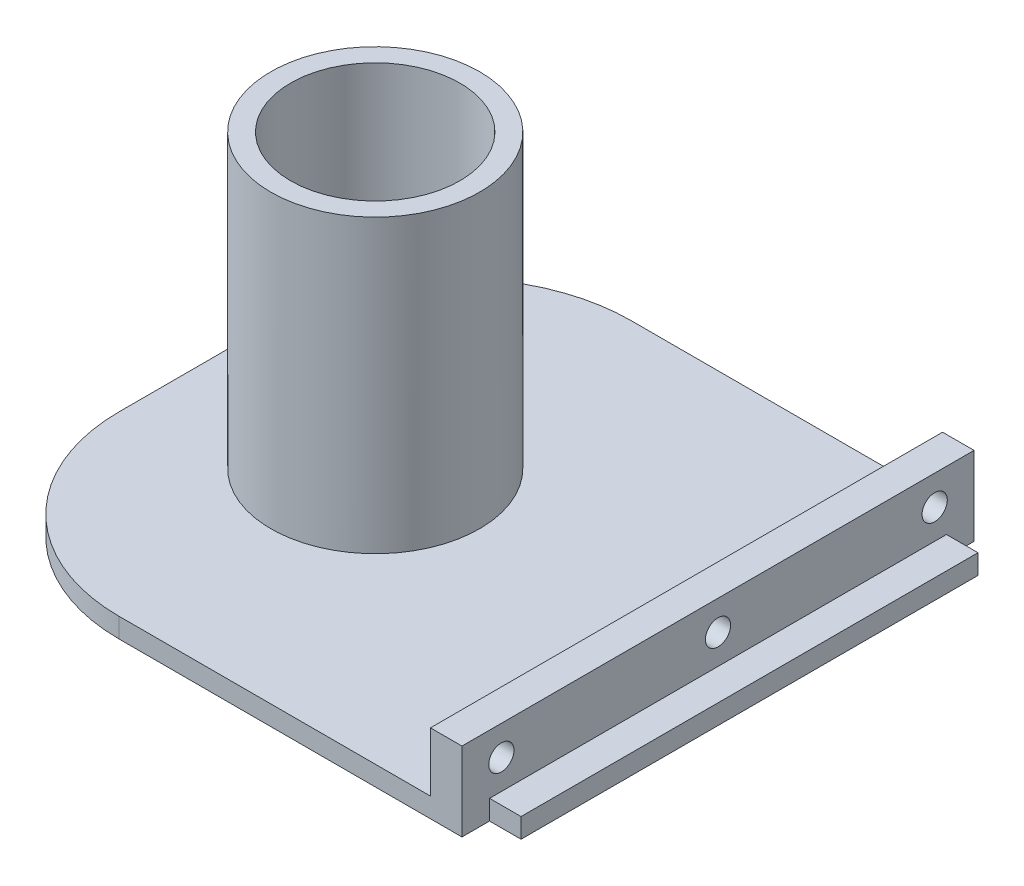
from build123d import *

# Parameters (mm, degrees)
BOSS_EXTRUDE1_DEPTH = 1.25
SKETCH3_R           = 13.25
SKETCH3_R_2         = 10.75
BOSS_EXTRUDE2_DEPTH = 37
SKETCH4_W           = 4
SKETCH4_H           = 65
BOSS_EXTRUDE3_DEPTH = 7.5
SKETCH5_R           = 1.6
CUT_EXTRUDE1_DEPTH  = 7.5
CHAMFER1_SIZE       = 1.5


with BuildPart() as part:
    # Sketch1 → Boss-Extrude1 (new, symmetric)
    with BuildSketch(Plane(origin=(0, 0, 0), x_dir=(1, 0, 0), z_dir=(0, 1, 0))):
        with BuildLine():
            Line((31, 32.5), (31, 29))
            Line((31, 29), (35, 29))
            Line((35, 29), (35, -29))
            Line((35, -29), (31, -29))
            Line((31, -29), (31, -32.5))
            Line((31, -32.5), (-12.51, -32.5))
            ThreePointArc((-12.51, -32.5), (-28.412831509, -25.912831509), (-35, -10.01))
            Line((-35, -10.01), (-35, 10.01))
            ThreePointArc((-35, 10.01), (-28.412831509, 25.912831509), (-12.51, 32.5))
            Line((-12.51, 32.5), (31, 32.5))
        make_face()
    extrude(amount=BOSS_EXTRUDE1_DEPTH, both=True)

    # Sketch3 → Boss-Extrude2 (add)
    with BuildSketch(Plane(origin=(0, 1.25, 0), x_dir=(1, 0, 0), z_dir=(0, 1, 0))):
        with Locations(Location((-12.51, 0, 0), (0, 0, 90))):
            Circle(SKETCH3_R)
        with Locations(Location((-12.51, 0, 0), (0, 0, 270))):
            Circle(SKETCH3_R_2, mode=Mode.SUBTRACT)
    extrude(amount=BOSS_EXTRUDE2_DEPTH)

    # Sketch4 → Boss-Extrude3 (add)
    with BuildSketch(Plane(origin=(0, 1.25, 0), x_dir=(1, 0, 0), z_dir=(0, 1, 0))):
        with Locations((29, 0)):
            Rectangle(SKETCH4_W, SKETCH4_H)
    extrude(amount=BOSS_EXTRUDE3_DEPTH)

    # Sketch5 → Cut-Extrude1 (cut)
    with BuildSketch(Plane.ZY.offset(-27)):
        with Locations((-27.5, 5)):
            Circle(SKETCH5_R)
        with Locations((0, 5)):
            Circle(SKETCH5_R)
        with Locations((27.5, 5)):
            Circle(SKETCH5_R)
    extrude(amount=-CUT_EXTRUDE1_DEPTH, mode=Mode.SUBTRACT)

    # Chamfer1
    chamfer1_edges = [part.edges().sort_by_distance(p)[0] for p in [
        (27, 5, -29.1),
        (27, 5, -1.6),
        (27, 5, 25.9),
    ]]
    chamfer(chamfer1_edges, length=CHAMFER1_SIZE)


solid = part.part
